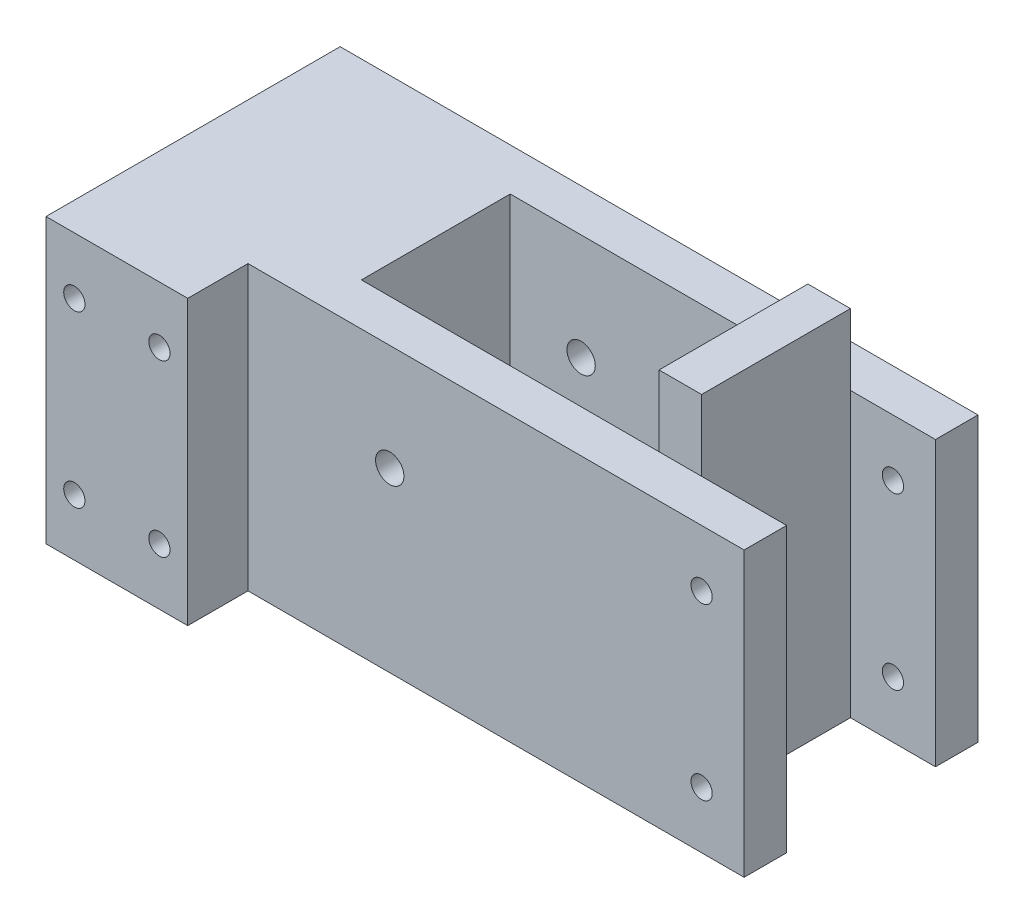
from build123d import *

# Parameters (mm, degrees)
EXTRUDE_1_DEPTH      = 40
SKETCH_7_W           = 20
SKETCH_7_H           = 8.5
EXTRUDE_5_DEPTH      = 40
SKETCH_8_R           = 1.5
CUT_EXTRUDE_2_DEPTH  = 107.874926901
SKETCH_9_R           = 1.5
CUT_EXTRUDE_3_DEPTH  = 107.874926901
EXTRUDE_6_DEPTH      = 10
EXTRUDE_6_DEPTH_BACK = 40
SKETCH_10_W          = 6
SKETCH_10_H          = 21
SKETCH_11_R          = 2
CUT_EXTRUDE_4_DEPTH  = 109.115678789


with BuildPart() as part:
    # 草图1 → 凸台-拉伸1 (new body)
    with BuildSketch(Plane(origin=(0, 0, 0), x_dir=(1, 0, 0), z_dir=(0, 1, 0))):
        Polygon((0, 0), (90, 0), (90, 6), (30, 6), (30, 27), (90, 27), (90, 33), (0, 33), align=None)
    extrude(amount=EXTRUDE_1_DEPTH)

    # 草图7 → 凸台-拉伸5 (add)
    with BuildSketch(Plane(origin=(0, 40, 0), x_dir=(1, 0, 0), z_dir=(0, 1, 0))):
        with Locations((10, -4.25)):
            Rectangle(SKETCH_7_W, SKETCH_7_H)
    extrude(amount=-EXTRUDE_5_DEPTH)

    # 草图8 → 切除-拉伸2 (cut, through all)
    with BuildSketch(Plane(origin=(0, 0, -33), x_dir=(-1, 0, 0), z_dir=(0, 0, -1))):
        with Locations((-84, 8)):
            Circle(SKETCH_8_R)
        with Locations((-84, 32)):
            Circle(SKETCH_8_R)
        with Locations((-16, 32)):
            Circle(SKETCH_8_R)
        with Locations((-16, 8)):
            Circle(SKETCH_8_R)
    extrude(amount=-CUT_EXTRUDE_2_DEPTH, mode=Mode.SUBTRACT)

    # 草图9 → 切除-拉伸3 (cut, through all)
    with BuildSketch(Plane.XY.offset(8.5)):
        with Locations((4, 32)):
            Circle(SKETCH_9_R)
        with Locations((4, 8)):
            Circle(SKETCH_9_R)
    extrude(amount=-CUT_EXTRUDE_3_DEPTH, mode=Mode.SUBTRACT)

    # 草图10 → 凸台-拉伸6 (add, two sides: drawn at the far end of the back side and taken through both)
    with BuildSketch(Plane(origin=(0, 40, 0), x_dir=(1, 0, 0), z_dir=(0, 1, 0)).offset(-EXTRUDE_6_DEPTH_BACK)):
        with Locations((75, 16.5)):
            Rectangle(SKETCH_10_W, SKETCH_10_H)
    extrude(amount=EXTRUDE_6_DEPTH + EXTRUDE_6_DEPTH_BACK)

    # 草图11 → 切除-拉伸4 (cut, through all)
    with BuildSketch(Plane.XY):
        with Locations((40, 25)):
            Circle(SKETCH_11_R)
    extrude(amount=-CUT_EXTRUDE_4_DEPTH, mode=Mode.SUBTRACT)


solid = part.part
